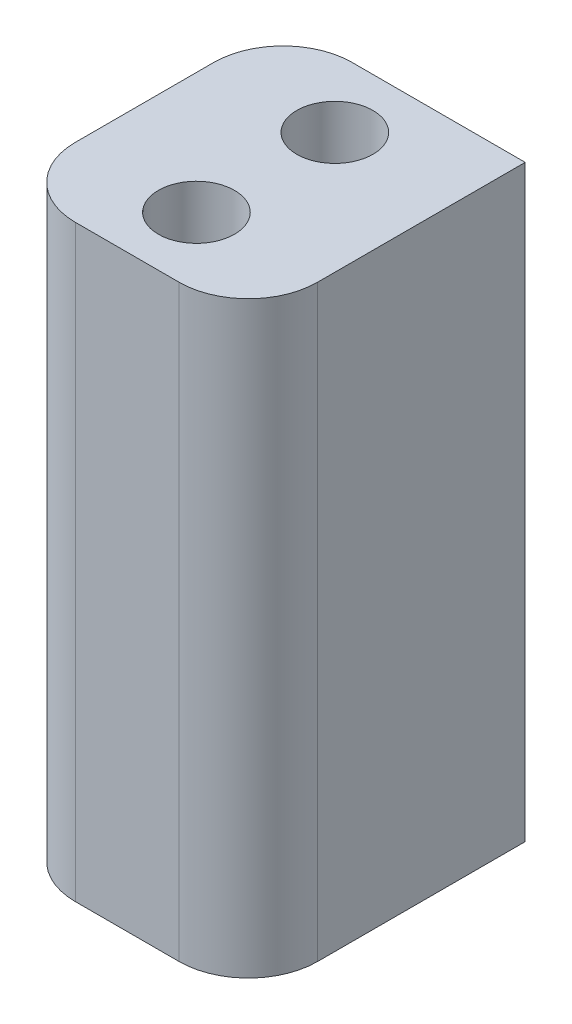
from build123d import *

# Parameters (mm, degrees)
SKETCH_1_W      = 7
SKETCH_1_H      = 8
SKETCH_1_R      = 1.1
EXTRUDE_1_DEPTH = 17
FILLET_1_R      = 2


with BuildPart() as part:
    # 草图1 → 凸台-拉伸1 (new body)
    with BuildSketch(Plane(origin=(0, 0, 0), x_dir=(1, 0, 0), z_dir=(0, 1, 0))):
        with Locations((3.5, 0)):
            Rectangle(SKETCH_1_W, SKETCH_1_H)
        with Locations(Location((3.5, -2, 0), (0, 0, 270))):
            Circle(SKETCH_1_R, mode=Mode.SUBTRACT)
        with Locations(Location((3.5, 2, 0), (0, 0, 270))):
            Circle(SKETCH_1_R, mode=Mode.SUBTRACT)
    extrude(amount=EXTRUDE_1_DEPTH)

    # 圆角1
    fillet_1_edges = [part.edges().sort_by_distance(p)[0] for p in [
        (7, 8.5, 4),
        (0, 8.5, 4),
        (0, 8.5, -4),
    ]]
    fillet(fillet_1_edges, radius=FILLET_1_R)


solid = part.part
